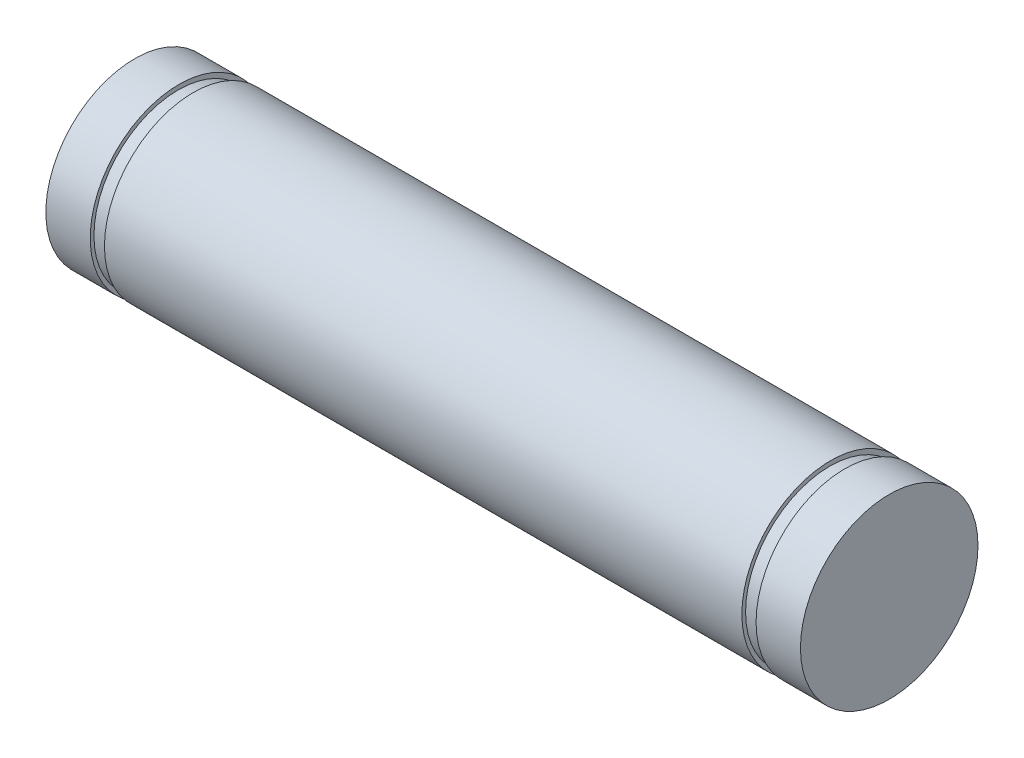
from build123d import *

# Parameters (mm, degrees)
SKETCH1_R           = 2
BOSS_EXTRUDE1_DEPTH = 17
SKETCH3_W           = 0.483504557
SKETCH3_H           = 0.32
SKETCH3_W_2         = 1.446691601


with BuildPart() as part:
    # Sketch1 → Boss-Extrude1 (new body)
    with BuildSketch(Plane(origin=(0, 0, 0), x_dir=(0, 0, -1), z_dir=(1, 0, 0))):
        Circle(SKETCH1_R)
    extrude(amount=BOSS_EXTRUDE1_DEPTH)

    # Sketch3 → Groove for ANSI B27.7 - 3AM1-4, Basic External Retaining Ring1 (revolve, cut)
    with BuildSketch(Plane(origin=(15, 0, 0), x_dir=(0, 0, 1), z_dir=(0, -1, 0))):
        with Locations((2.158247722, -0.84)):
            Rectangle(SKETCH3_W, SKETCH3_H)
        with Locations((2.639841244, 13.84)):
            Rectangle(SKETCH3_W_2, SKETCH3_H)
    revolve(axis=Axis((67.749749937, 0, 0.016495443), (-1, 0, 0)), mode=Mode.SUBTRACT)


solid = part.part
